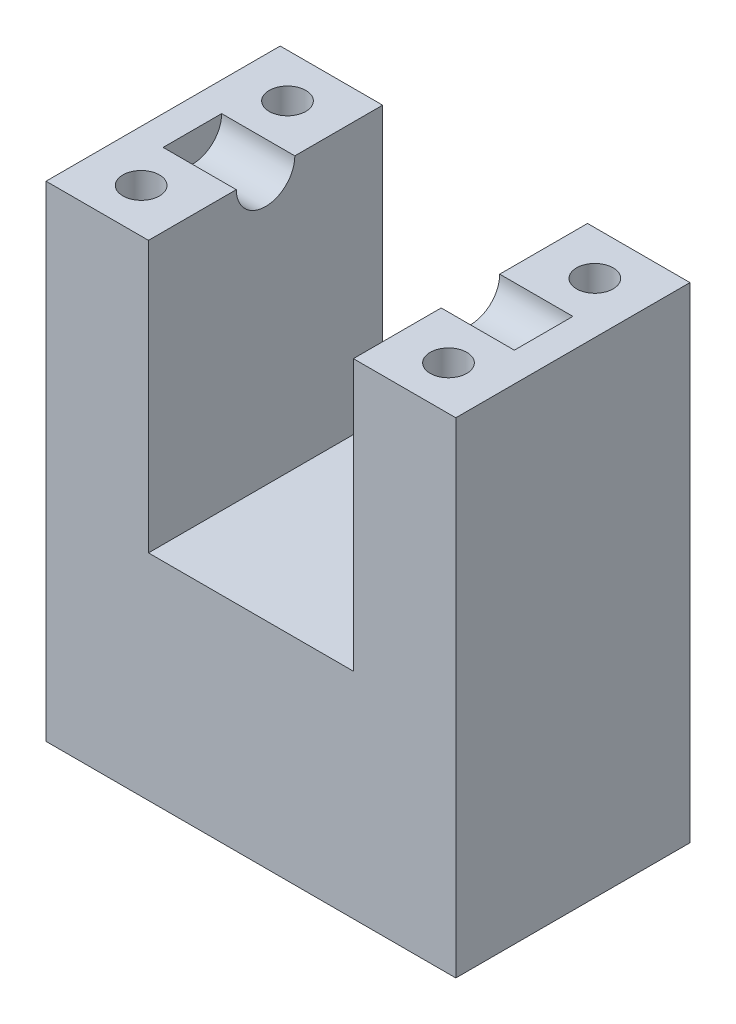
from build123d import *

# Parameters (mm, degrees)
L_BASE_DEPTH                                = 12.7
SKETCH3_W                                   = 44.45
SKETCH3_H                                   = 25.4
RECTANGULAR_EXTRUDE_DEPTH                   = 10.5664
SKETCH4_W                                   = 11.1125
SKETCH4_H                                   = 25.4
FORK_EXTRUDE_DEPTH                          = 29.3624
SKETCH6_W                                   = 38.1
SKETCH6_H                                   = 3.175
F_4_EXPANSION_INSERT_RECESSES_1_D           = 3.2639
F_4_EXPANSION_INSERT_RECESSES_1_DEPTH       = 19.05
F_4_EXPANSION_INSERT_RECESSES_1_CBORE_D     = 3.96875
F_4_EXPANSION_INSERT_RECESSES_1_CBORE_DEPTH = 4.7625
F_4_EXPANSION_INSERT_RECESSES_1_TIP         = 0.980574487
F_4_EXPANSION_INSERT_RECESSES_2_D           = 3.2639
F_4_EXPANSION_INSERT_RECESSES_2_DEPTH       = 9.525
F_4_EXPANSION_INSERT_RECESSES_2_CBORE_D     = 3.96875
F_4_EXPANSION_INSERT_RECESSES_2_CBORE_DEPTH = 4.7625
F_4_EXPANSION_INSERT_RECESSES_2_TIP         = 0.980574487


with BuildPart() as part:
    # Sketch1 → L-Base (new body)
    with BuildSketch(Plane(origin=(0, 0, 0), x_dir=(1, 0, 0), z_dir=(0, 1, 0))):
        Polygon((0, 0), (44.45, 0), (44.45, 25.4), (20.066, 25.4), (20.066, 39.116), (0, 39.116), align=None)
    extrude(amount=L_BASE_DEPTH)

    # Sketch3 → Rectangular Extrude (add)
    with BuildSketch(Plane(origin=(0, 12.7, 0), x_dir=(1, 0, 0), z_dir=(0, 1, 0))):
        with Locations((22.225, 12.7)):
            Rectangle(SKETCH3_W, SKETCH3_H)
    extrude(amount=RECTANGULAR_EXTRUDE_DEPTH)

    # Sketch4 → Fork Extrude (add)
    with BuildSketch(Plane(origin=(0, 23.2664, 0), x_dir=(1, 0, 0), z_dir=(0, 1, 0))):
        with Locations((5.55625, 12.7)):
            Rectangle(SKETCH4_W, SKETCH4_H)
        with Locations((38.89375, 12.7)):
            Rectangle(SKETCH4_W, SKETCH4_H)
    extrude(amount=FORK_EXTRUDE_DEPTH)

    # Sketch6 → Shaft Recess (revolve, cut)
    with BuildSketch(Plane(origin=(0, 52.6288, 0), x_dir=(1, 0, 0), z_dir=(0, 1, 0))):
        with Locations((22.225, 11.1125)):
            Rectangle(SKETCH6_W, SKETCH6_H)
    revolve(axis=Axis((0, 52.6288, -12.7), (1, 0, 0)), mode=Mode.SUBTRACT)

    # #4 Expansion Insert Recesses #1
    with Locations(Plane(origin=(0, 52.6288, 0), x_dir=(1, 0, 0), z_dir=(0, 1, 0))):
        with Locations((5.55625, 20.6375), (5.55625, 4.7625), (38.89375, 20.6375), (38.89375, 4.7625)):
            CounterBoreHole(F_4_EXPANSION_INSERT_RECESSES_1_D / 2, F_4_EXPANSION_INSERT_RECESSES_1_CBORE_D / 2, F_4_EXPANSION_INSERT_RECESSES_1_CBORE_DEPTH, depth=F_4_EXPANSION_INSERT_RECESSES_1_DEPTH)
            with Locations((0, 0, -(F_4_EXPANSION_INSERT_RECESSES_1_DEPTH + F_4_EXPANSION_INSERT_RECESSES_1_TIP / 2))):  # 118° drill point
                Cone(0, F_4_EXPANSION_INSERT_RECESSES_1_D / 2, F_4_EXPANSION_INSERT_RECESSES_1_TIP, mode=Mode.SUBTRACT)

    # #4 Expansion Insert Recesses #2
    with Locations(Plane(origin=(0, 0, 0), x_dir=(-1, 0, 0), z_dir=(0, -1, 0))):
        with Locations((-10.033, 10.033), (-29.083, 10.033), (-10.033, 29.083)):
            CounterBoreHole(F_4_EXPANSION_INSERT_RECESSES_2_D / 2, F_4_EXPANSION_INSERT_RECESSES_2_CBORE_D / 2, F_4_EXPANSION_INSERT_RECESSES_2_CBORE_DEPTH, depth=F_4_EXPANSION_INSERT_RECESSES_2_DEPTH)
            with Locations((0, 0, -(F_4_EXPANSION_INSERT_RECESSES_2_DEPTH + F_4_EXPANSION_INSERT_RECESSES_2_TIP / 2))):  # 118° drill point
                Cone(0, F_4_EXPANSION_INSERT_RECESSES_2_D / 2, F_4_EXPANSION_INSERT_RECESSES_2_TIP, mode=Mode.SUBTRACT)


solid = part.part
